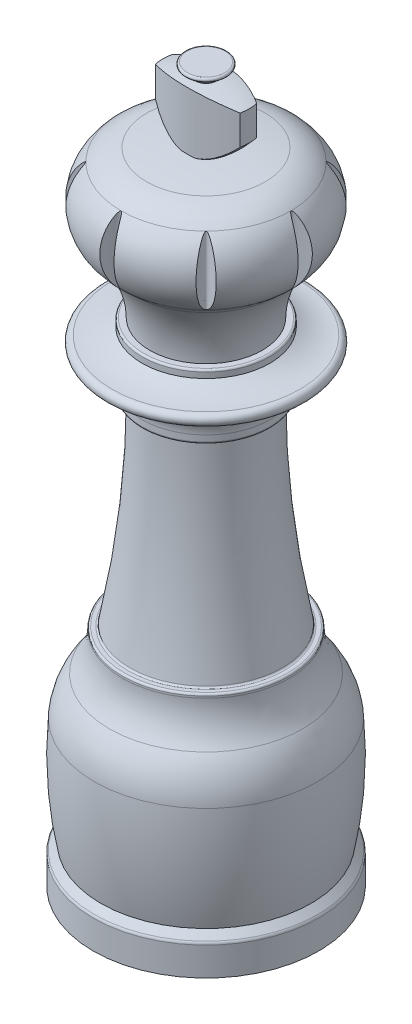
from build123d import *

# Parameters (mm, degrees)
CUT_EXTRUDE2_REACH            = 97.823
CUT_EXTRUDE2_END_MAJOR_RADIUS = 1
CUT_EXTRUDE2_END_MINOR_RADIUS = 47.5
CUT_EXTRUDE3_REACH            = 97.823
CIRPATTERN1_COUNT             = 8
SCALE1_SCALE                  = 0.766666667
SKETCH4_R                     = 10.2
CUT_EXTRUDE4_DEPTH            = 7
SKETCH9_W                     = 10.75
SKETCH9_H                     = 1


with BuildPart() as part:
    # Sketch1 → Revolve1 (revolve)
    with BuildSketch(Plane(origin=(0, 0, 0), x_dir=(0, 0, -1), z_dir=(1, 0, 0))):
        with BuildLine():
            Line((0, 95), (-2.5, 95))
            ThreePointArc((-2.5, 95), (-2.734923155, 94.835505036), (-2.660696902, 94.558488889))
            Line((-2.660696902, 94.558488889), (-1.334790711, 93.445921493))
            ThreePointArc((-1.334790711, 93.445921493), (-3.576140289, 93.107799994), (-5.75, 92.465687828))
            Line((-5.75, 92.465687828), (-5.75, 88.526819967))
            ThreePointArc((-5.75, 88.526819967), (-4.288653131, 86.96603513), (-2.637748776, 85.607322951))
            ThreePointArc((-2.637748776, 85.607322951), (-5.280067885, 85.442340866), (-7.909090909, 85.13039968))
            ThreePointArc((-7.909090909, 85.13039968), (-9.735263045, 84.56655175), (-11.305654097, 83.477193634))
            add(Edge.make_bspline(
                [(-11.305654097, 83.477193634), (-11.306548171, 83.476343481), (-11.308449321, 83.474535724), (-11.32266134, 83.46096577), (-11.344100986, 83.440320467), (-11.373732882, 83.411453676), (-11.411080339, 83.374500557), (-11.45613643, 83.329058964), (-11.508637107, 83.274880526), (-11.568308722, 83.21163566), (-11.634790911, 83.138987904), (-11.707665754, 83.056565249), (-11.864418879, 82.872343874), (-12.110093618, 82.552289845), (-12.545256174, 81.86726558), (-13.002221565, 80.816653144), (-13.225854055, 79.623406493), (-13.234343469, 78.61715561), (-13.146066684, 77.831835879), (-12.958605246, 77.057734051), (-12.664266256, 76.289021691), (-12.289671051, 75.598207181), (-11.950970362, 75.127058177), (-11.72681665, 74.858683276), (-11.620571361, 74.738548875), (-11.528058159, 74.638935799), (-11.450612647, 74.558857778), (-11.3885639, 74.496781454), (-11.34362779, 74.452898801), (-11.312351476, 74.422909272), (-11.307722305, 74.418509674), (-11.305654097, 74.416544034)],
                knots=[0, 0, 0, 0, 0.00313144, 0.00665866, 0.01085027, 0.015869374, 0.021811359, 0.028733598, 0.036672263, 0.045651261, 0.055687079, 0.066791497, 0.078973191, 0.128416372, 0.18632242, 0.31672968, 0.457733945, 0.531385888, 0.604593059, 0.683894103, 0.759896263, 0.842131054, 0.912262867, 0.930726604, 0.946895633, 0.960797586, 0.972476272, 0.982006225, 0.989526093, 0.995320499, 1, 1, 1, 1], degree=3))
            ThreePointArc((-11.305654097, 74.416544034), (-11.004132397, 74.147970654), (-10.685897436, 73.899427889))
            ThreePointArc((-10.685897436, 73.899427889), (-10.247743904, 73.520045962), (-9.878205128, 73.073559392))
            ThreePointArc((-9.878205128, 73.073559392), (-8.108524966, 69.468820326), (-7.5, 65.499486758))
            Line((-7.5, 65.499486758), (-8.25, 65.499486758))
            ThreePointArc((-8.25, 65.499486758), (-8.426776695, 65.426263453), (-8.5, 65.249486758))
            Line((-8.5, 65.249486758), (-8.5, 64.499486758))
            ThreePointArc((-8.5, 64.499486758), (-10.438447187, 63.753275507), (-12.5, 63.499486758))
            ThreePointArc((-12.5, 63.499486758), (-13.25, 62.749486758), (-12.5, 61.999486758))
            ThreePointArc((-12.5, 61.999486758), (-9.671572875, 60.827913883), (-8.5, 57.999486758))
            Line((-8.5, 57.999486758), (-8.5, 57.183986442))
            ThreePointArc((-8.5, 57.183986442), (-8.426776695, 57.007209746), (-8.25, 56.933986442))
            Line((-8.25, 56.933986442), (-7.75, 56.933986442))
            ThreePointArc((-7.75, 56.933986442), (-7.573223305, 56.860763137), (-7.5, 56.683986442))
            ThreePointArc((-7.5, 56.683986442), (-8.157370293, 43.377678032), (-10.123079163, 30.200957354))
            ThreePointArc((-10.123079163, 30.200957354), (-10.20972975, 30.056660064), (-10.368221609, 30))
            Line((-10.368221609, 30), (-10.868221609, 30))
            ThreePointArc((-10.868221609, 30), (-11.044998304, 29.926776695), (-11.118221609, 29.75))
            Line((-11.118221609, 29.75), (-11.118221609, 29.5))
            ThreePointArc((-11.118221609, 29.5), (-11.563039127, 26.869559416), (-12.848026026, 24.531635345))
            ThreePointArc((-12.848026026, 24.531635345), (-14.226886449, 22.132425629), (-14.843478261, 19.434782609))
            ThreePointArc((-14.843478261, 19.434782609), (-14.908268747, 12.188961562), (-14, 5))
            Line((-14, 5), (-14.853553391, 4.146446609))
            ThreePointArc((-14.853553391, 4.146446609), (-14.961939766, 3.984234935), (-15, 3.792893219))
            Line((-15, 3.792893219), (-15, 0))
            Line((-15, 0), (0, 0))
            Line((0, 0), (0, 95))
        make_face()
    revolve(axis=Axis((0, 0, 0), (0, -1, 0)))

    # Cut-Extrude2: up to this torus (the profile starts outside it)
    cut_extrude2_end = Plane(origin=(0, 38.135565253, 0), z_dir=(0, 1, 0)) * Torus(CUT_EXTRUDE2_END_MAJOR_RADIUS, CUT_EXTRUDE2_END_MINOR_RADIUS, mode=Mode.PRIVATE)
    # Sketch3 → Cut-Extrude2 (cut, up to the surface)
    with BuildSketch(Plane(origin=(0, 93.445921493, 0), x_dir=(1, 0, 0), z_dir=(0, 1, 0)), mode=Mode.PRIVATE) as cut_extrude2_sk1:
        with BuildLine():
            ThreePointArc((-5.643115564, 1.103515625), (0, 2.5), (5.643115564, 1.103515625))
            ThreePointArc((5.643115564, 1.103515625), (0, 5.75), (-5.643115564, 1.103515625))
        make_face()
    cut_extrude2_tool1 = extrude(cut_extrude2_sk1.sketch, amount=-CUT_EXTRUDE2_REACH, mode=Mode.PRIVATE) - cut_extrude2_end
    add(cut_extrude2_tool1.solids().sort_by_distance((0, 93.445921, -3.558898))[0], mode=Mode.SUBTRACT)
    # Sketch3 → Cut-Extrude2 (cut, up to the surface)
    with BuildSketch(Plane(origin=(0, 93.445921493, 0), x_dir=(1, 0, 0), z_dir=(0, 1, 0)), mode=Mode.PRIVATE) as cut_extrude2_sk2:
        with BuildLine():
            ThreePointArc((5.643115564, -1.103515625), (0, -2.5), (-5.643115564, -1.103515625))
            ThreePointArc((-5.643115564, -1.103515625), (0, -5.75), (5.643115564, -1.103515625))
        make_face()
    cut_extrude2_tool2 = extrude(cut_extrude2_sk2.sketch, amount=-CUT_EXTRUDE2_REACH, mode=Mode.PRIVATE) - cut_extrude2_end
    add(cut_extrude2_tool2.solids().sort_by_distance((0, 93.445921, 3.558898))[0], mode=Mode.SUBTRACT)

    # Cut-Extrude3: up to this face of the body (flat: up to its plane)
    cut_extrude3_end = Plane(part.part.faces().sort_by_distance((0, 65.499486758, -7.733345238))[0])
    # Sketch3<3> → Cut-Extrude3 (cut, up to the picked face)
    with BuildSketch(Plane(origin=(0, 93.445921493, 0), x_dir=(1, 0, 0), z_dir=(0, 1, 0)), mode=Mode.PRIVATE) as cut_extrude3_sk1:
        with BuildLine():
            ThreePointArc((13.19433156, -0.935297507), (13.227435766, 0.010479048), (13.192833075, 0.956201964))
            add(Edge.make_bspline(
                [(13.192833075, 0.956201964), (10.662902661, 0.008119881), (13.19433156, -0.935297507)],
                knots=[0.004254899, 0.004254899, 0.004254899, 0.446534844, 0.446534844, 0.446534844], degree=2, weights=[1.037398157, 2.962572799, 1.037456245]))
        make_face()
    cut_extrude3_tool1 = split(extrude(cut_extrude3_sk1.sketch, amount=-CUT_EXTRUDE3_REACH, mode=Mode.PRIVATE), bisect_by=cut_extrude3_end, keep=Keep.BOTH, mode=Mode.PRIVATE)
    cut_extrude3 = cut_extrude3_tool1.solids().sort_by(Axis((12.497616, 93.445921, -0.009812), (0, -1, 0)))[0]
    add(cut_extrude3, mode=Mode.SUBTRACT)

    # CirPattern1: Cut-Extrude3 ×8 about axis
    cirpattern1_axis = Axis((0, 0, 0), (0, -1, 0))
    for i in range(1, CIRPATTERN1_COUNT):
        add(cut_extrude3.rotate(cirpattern1_axis, i * 360 / CIRPATTERN1_COUNT), mode=Mode.SUBTRACT)


with BuildPart() as part_1:
    # Scale1: scaled about (0, 0, 0)
    add(part.part.scale(SCALE1_SCALE))

    # Sketch4 → Cut-Extrude4 (cut)
    with BuildSketch(Plane.XZ):
        with Locations(Location((0, 0, 0), (0, 0, 270))):
            Circle(SKETCH4_R)
    extrude(amount=-CUT_EXTRUDE4_DEPTH, mode=Mode.SUBTRACT)

    # Sketch9 → Cut-Revolve1 (revolve, cut)
    with BuildSketch(Plane.XY, mode=Mode.PRIVATE) as cut_revolve1_sk:
        with Locations((-5.375, 0.5)):
            Rectangle(SKETCH9_W, SKETCH9_H)
    revolve(cut_revolve1_sk.sketch.rotate(Axis((0, 0, 0), (0, -1, 0)), 270), axis=Axis((0, 0, 0), (0, -1, 0)), mode=Mode.SUBTRACT)


with BuildPart() as body_2:
    # Sketch11 → Revolve2 (revolve)
    with BuildSketch(Plane.XY, mode=Mode.PRIVATE) as revolve2_sk:
        Polygon((0, 0), (0, 8.5), (-10, 8.5), (-10, 1), (-10.55, 1), (-10.55, 0), align=None)
    revolve(revolve2_sk.sketch.rotate(Axis((0, 0, 0), (0, -1, 0)), 270), axis=Axis((0, 0, 0), (0, -1, 0)))


solid = Compound([part_1.part, body_2.part])
